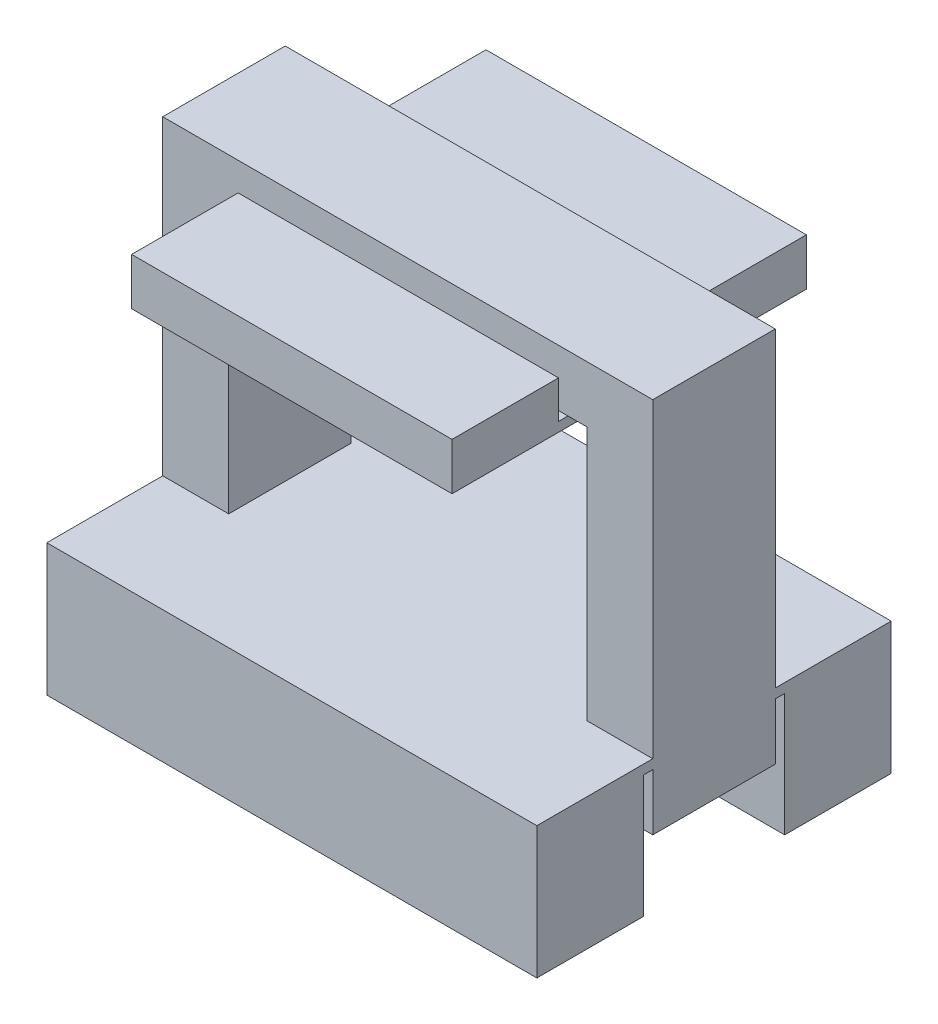
from build123d import *

# Parameters (mm, degrees)
SKETCH_2_W           = 26
SKETCH_2_H           = 6.5
EXTRUDE_1_DEPTH      = 20
SKETCH_3_W           = 19
SKETCH_3_H           = 14
CUT_EXTRUDE_2_DEPTH  = 25.72347063
EXTRUDE_3_DEPTH      = 0.5
EXTRUDE_3_DEPTH_BACK = 2
SKETCH_4_W           = 17
SKETCH_4_H           = 18.8
SKETCH_5_W           = 0.5
SKETCH_5_H           = 2
CUT_EXTRUDE_4_DEPTH  = 31.831963934
EXTRUDE_7_DEPTH      = 0.5
EXTRUDE_7_DEPTH_BACK = 6.5
SKETCH_6_W           = 26
SKETCH_6_H           = 18.8
CUT_EXTRUDE_8_DEPTH  = 35.122719704


with BuildPart() as part:
    # Эскиз2 → Вытянуть1 (new body)
    with BuildSketch(Plane(origin=(0, 0, 0), x_dir=(1, 0, 0), z_dir=(0, 1, 0))):
        Rectangle(SKETCH_2_W, SKETCH_2_H)
    extrude(amount=EXTRUDE_1_DEPTH)

    # Эскиз3 → Вытянуть2 (cut, through all)
    with BuildSketch(Plane.XY.offset(3.25)):
        with Locations((0, 10)):
            Rectangle(SKETCH_3_W, SKETCH_3_H)
    extrude(amount=-CUT_EXTRUDE_2_DEPTH, mode=Mode.SUBTRACT)

    # Эскиз4 → Вытянуть3 (add, two sides: drawn at the far end of the back side and taken through both)
    with BuildSketch(Plane.XZ.offset(-17).offset(-EXTRUDE_3_DEPTH_BACK)):
        Rectangle(SKETCH_4_W, SKETCH_4_H)
    extrude(amount=EXTRUDE_3_DEPTH + EXTRUDE_3_DEPTH_BACK)

    # Эскиз5 → Вытянуть4 (cut, through all)
    with BuildSketch(Plane(origin=(8.5, 0, 0), x_dir=(0, 0, -1), z_dir=(1, 0, 0))):
        with Locations((-3.5, 18)):
            Rectangle(SKETCH_5_W, SKETCH_5_H)
        with Locations((3.5, 18)):
            Rectangle(SKETCH_5_W, SKETCH_5_H)
    extrude(amount=-CUT_EXTRUDE_4_DEPTH, mode=Mode.SUBTRACT)

    # Эскиз6 → Вытянуть7 (add, two sides: drawn at the far end of the back side and taken through both)
    with BuildSketch(Plane(origin=(0, 3, 0), x_dir=(-1, 0, 0), z_dir=(0, 1, 0)).offset(-EXTRUDE_7_DEPTH_BACK)):
        Rectangle(SKETCH_6_W, SKETCH_6_H)
    extrude(amount=EXTRUDE_7_DEPTH + EXTRUDE_7_DEPTH_BACK)

    # Эскиз9 → Вытянуть8 (cut, through all)
    with BuildSketch(Plane(origin=(13, 0, 0), x_dir=(0, 0, -1), z_dir=(1, 0, 0))):
        Polygon((-3.25, 0), (-3.25, 3), (-3.75, 3), (-3.75, -3.5), (3.75, -3.5), (3.75, 3), (3.25, 3), (3.25, 0), align=None)
    extrude(amount=-CUT_EXTRUDE_8_DEPTH, mode=Mode.SUBTRACT)


solid = part.part
